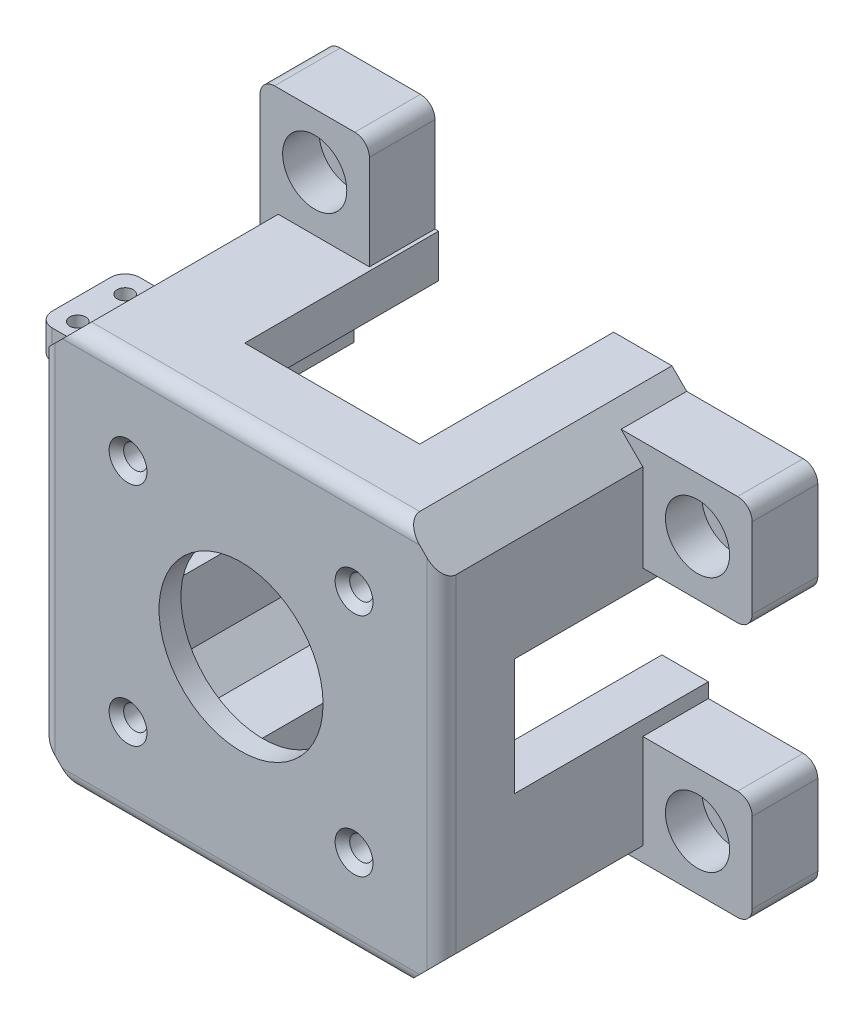
from build123d import *

# Parameters (mm, degrees)
SKETCH2_W           = 55
SKETCH2_H           = 55
BOSS_EXTRUDE1_DEPTH = 33.6
BOSS_EXTRUDE2_DEPTH = 3
SKETCH4_W           = 15
SKETCH4_H           = 15
SKETCH4_R           = 2.6
BOSS_EXTRUDE3_DEPTH = 9
CUT_EXTRUDE1_START  = -5
SKETCH6_R           = 4.4
SKETCH6_R_2         = 2.6
CUT_EXTRUDE1_DEPTH  = 5
CHAMFER1_SIZE       = 5
FILLET4_R           = 2
SKETCH7_W           = 24
SKETCH7_H           = 26.6
CUT_EXTRUDE2_DEPTH  = 67
SKETCH8_W           = 26.6
SKETCH8_H           = 16
CUT_EXTRUDE3_DEPTH  = 67
SKETCH11_W          = 12
SKETCH11_H          = 4
BOSS_EXTRUDE4_DEPTH = 5
SKETCH12_R          = 1.1
CUT_EXTRUDE5_DEPTH  = 4
FILLET8_R           = 2
SKETCH13_R          = 1.6
CUT_EXTRUDE6_DEPTH  = 10
CHAMFER2_SIZE       = 1


with BuildPart() as part:
    # Sketch2 → Boss-Extrude1 (new body)
    with BuildSketch(Plane.XY):
        with Locations((0, 0.476186899)):
            Rectangle(SKETCH2_W, SKETCH2_H)
        Polygon((21.118377871, -17.280631787), (21.118377871, 17.280631787), (17.280631787, 21.118377871), (-17.280631787, 21.118377871), (-21.118377871, 17.280631787), (-21.118377871, -17.280631787), (-17.280631787, -21.118377871), (17.280631787, -21.118377871), align=None, mode=Mode.SUBTRACT)
    extrude(amount=BOSS_EXTRUDE1_DEPTH)

    # Sketch3 → Boss-Extrude2 (add)
    with BuildSketch(Plane.XY.offset(33.6)):
        with BuildLine():
            Line((-7.954951288, 8.431138187), (-18.961411379, 19.437598278))
            Line((-18.961411379, 19.437598278), (-21.118377871, 17.280631787))
            Line((-21.118377871, 17.280631787), (-21.118377871, -17.280631787))
            Line((-21.118377871, -17.280631787), (-19.437598278, -18.961411379))
            Line((-19.437598278, -18.961411379), (-7.954951288, -7.478764389))
            ThreePointArc((-7.954951288, -7.478764389), (-11.25, 0.476186899), (-7.954951288, 8.431138187))
        make_face()
        with BuildLine():
            Line((-7.954951288, -7.478764389), (-19.437598278, -18.961411379))
            Line((-19.437598278, -18.961411379), (-17.280631787, -21.118377871))
            Line((-17.280631787, -21.118377871), (17.280631787, -21.118377871))
            Line((17.280631787, -21.118377871), (19.437598278, -18.961411379))
            Line((19.437598278, -18.961411379), (7.954951288, -7.478764389))
            ThreePointArc((7.954951288, -7.478764389), (0, -10.773813101), (-7.954951288, -7.478764389))
        make_face()
        with BuildLine():
            Line((21.118377871, 17.280631787), (18.961411379, 19.437598278))
            Line((18.961411379, 19.437598278), (7.954951288, 8.431138187))
            ThreePointArc((7.954951288, 8.431138187), (10.393644741, 4.781375513), (11.25, 0.476186899))
            ThreePointArc((11.25, 0.476186899), (10.393644741, -3.829001715), (7.954951288, -7.478764389))
            Line((7.954951288, -7.478764389), (19.437598278, -18.961411379))
            Line((19.437598278, -18.961411379), (21.118377871, -17.280631787))
            Line((21.118377871, -17.280631787), (21.118377871, 17.280631787))
        make_face()
        with BuildLine():
            Line((-17.280631787, 21.118377871), (-18.961411379, 19.437598278))
            Line((-18.961411379, 19.437598278), (-7.954951288, 8.431138187))
            ThreePointArc((-7.954951288, 8.431138187), (0, 11.726186899), (7.954951288, 8.431138187))
            Line((7.954951288, 8.431138187), (18.961411379, 19.437598278))
            Line((18.961411379, 19.437598278), (17.280631787, 21.118377871))
            Line((17.280631787, 21.118377871), (-17.280631787, 21.118377871))
        make_face()
        Polygon((-18.961411379, 19.437598278), (-27.5, 27.976186899), (-27.5, -27.023813101), (-19.437598278, -18.961411379), (-21.118377871, -17.280631787), (-21.118377871, 17.280631787), align=None)
        Polygon((-19.437598278, -18.961411379), (-27.5, -27.023813101), (27.5, -27.023813101), (19.437598278, -18.961411379), (17.280631787, -21.118377871), (-17.280631787, -21.118377871), align=None)
        Polygon((27.5, -27.023813101), (27.5, 27.976186899), (18.961411379, 19.437598278), (21.118377871, 17.280631787), (21.118377871, -17.280631787), (19.437598278, -18.961411379), align=None)
        Polygon((27.5, 27.976186899), (-27.5, 27.976186899), (-18.961411379, 19.437598278), (-17.280631787, 21.118377871), (17.280631787, 21.118377871), (18.961411379, 19.437598278), align=None)
    extrude(amount=BOSS_EXTRUDE2_DEPTH)

    # Sketch4 → Boss-Extrude3 (add)
    # profile 1 of 4: a face of its own
    with BuildSketch(Plane(origin=(0, 0, 0), x_dir=(-1, 0, 0), z_dir=(0, 0, -1))):
        with Locations((-35, 17.5)):
            Rectangle(SKETCH4_W, SKETCH4_H)
        with Locations((-35, 17.5)):
            Circle(SKETCH4_R, mode=Mode.SUBTRACT)
    # profile 2 of 4: a face of its own
    with BuildSketch(Plane(origin=(0, 0, 0), x_dir=(-1, 0, 0), z_dir=(0, 0, -1))):
        with Locations((35, 17.5)):
            Rectangle(SKETCH4_W, SKETCH4_H)
        with Locations((35, 17.5)):
            Circle(SKETCH4_R, mode=Mode.SUBTRACT)
    # profile 3 of 4: a face of its own
    with BuildSketch(Plane(origin=(0, 0, 0), x_dir=(-1, 0, 0), z_dir=(0, 0, -1))):
        with Locations((-35, -17.5)):
            Rectangle(SKETCH4_W, SKETCH4_H)
        with Locations((-35, -17.5)):
            Circle(SKETCH4_R, mode=Mode.SUBTRACT)
    # profile 4 of 4: a face of its own
    with BuildSketch(Plane(origin=(0, 0, 0), x_dir=(-1, 0, 0), z_dir=(0, 0, -1))):
        with Locations((17.5, -34.523813101)):
            Rectangle(SKETCH4_W, SKETCH4_H)
        with Locations((17.5, -34.523813101)):
            Circle(SKETCH4_R, mode=Mode.SUBTRACT)
    extrude(amount=-BOSS_EXTRUDE3_DEPTH)

    # Sketch6 → Cut-Extrude1 (cut)
    # profile 1 of 4: a face of its own
    with BuildSketch(Plane.XY.offset(9).offset(CUT_EXTRUDE1_START)):
        with Locations((-17.5, -34.523813101)):
            Circle(SKETCH6_R)
    # profile 2 of 4: a face of its own
    with BuildSketch(Plane.XY.offset(9).offset(CUT_EXTRUDE1_START)):
        with Locations((-35, 17.5)):
            Circle(SKETCH6_R)
    # profile 3 of 4: a face of its own
    with BuildSketch(Plane.XY.offset(9).offset(CUT_EXTRUDE1_START)):
        with Locations((35, -17.5)):
            Circle(SKETCH6_R)
        with Locations(Location((35, -17.5, 0), (0, 0, 180))):
            Circle(SKETCH6_R_2, mode=Mode.SUBTRACT)
    # profile 4 of 4: a face of its own
    with BuildSketch(Plane.XY.offset(9).offset(CUT_EXTRUDE1_START)):
        with Locations((35, 17.5)):
            Circle(SKETCH6_R)
    extrude(amount=CUT_EXTRUDE1_DEPTH, mode=Mode.SUBTRACT)

    # Chamfer1
    chamfer1_edges = [part.edges().sort_by_distance(p)[0] for p in [
        (27.5, -27.023813101, 18.3),
        (-27.5, -27.023813101, 18.3),
        (27.5, 27.976186899, 18.3),
        (-27.5, 27.976186899, 18.3),
    ]]
    chamfer(chamfer1_edges, length=CHAMFER1_SIZE)

    # Fillet4
    fillet4_edges = [part.edges().sort_by_distance(p)[0] for p in [
        (0, 27.976186899, 36.6),
        (27.5, 0.476186899, 36.6),
        (0, -27.023813101, 36.6),
        (-27.5, 0.476186899, 36.6),
        (-25, -42.023813101, 4.5),
        (-10, -42.023813101, 4.5),
        (-42.5, 10, 4.5),
        (-42.5, 25, 4.5),
        (42.5, -25, 4.5),
        (42.5, -10, 4.5),
        (42.5, 10, 4.5),
        (42.5, 25, 4.5),
    ]]
    fillet(fillet4_edges, radius=FILLET4_R)

    # Sketch7 → Cut-Extrude2 (cut)
    with BuildSketch(Plane.XZ.offset(27.023813101)):
        with Locations((2.5, 13.3)):
            Rectangle(SKETCH7_W, SKETCH7_H)
    extrude(amount=-CUT_EXTRUDE2_DEPTH, mode=Mode.SUBTRACT)

    # Sketch8 → Cut-Extrude3 (cut)
    with BuildSketch(Plane.ZY.offset(27.5)):
        with Locations((13.3, 0)):
            Rectangle(SKETCH8_W, SKETCH8_H)
    extrude(amount=-CUT_EXTRUDE3_DEPTH, mode=Mode.SUBTRACT)


with BuildPart() as body_2:
    # Mirror2: mirrored copy
    add(part.part.mirror(Plane(origin=(-25, -42.023813101, 9), x_dir=(0, 0, 1), z_dir=(0, 1, 0))))

    # Sketch11 → Boss-Extrude4 (add)
    with BuildSketch(Plane.ZY.offset(27.5)):
        with Locations((26, -65.023813101)):
            Rectangle(SKETCH11_W, SKETCH11_H)
    extrude(amount=BOSS_EXTRUDE4_DEPTH)

    # Sketch12 → Cut-Extrude5 (cut)
    with BuildSketch(Plane.XZ.offset(67.023813101)):
        with Locations(Location((-29.5, 29.5, 0), (0, 0, 270))):
            Circle(SKETCH12_R)
        with Locations(Location((-29.5, 23, 0), (0, 0, 270))):
            Circle(SKETCH12_R)
    extrude(amount=-CUT_EXTRUDE5_DEPTH, mode=Mode.SUBTRACT)

    # Fillet8
    fillet8_edges = [body_2.edges().sort_by_distance(p)[0] for p in [
        (-32.5, -65.023813101, 32),
        (-32.5, -65.023813101, 20),
    ]]
    fillet(fillet8_edges, radius=FILLET8_R)

    # Sketch13 → Cut-Extrude6 (cut)
    with BuildSketch(Plane.XY.offset(36.6)):
        with Locations((15.5, -100.023813101)):
            Circle(SKETCH13_R)
        with Locations((-15.5, -100.023813101)):
            Circle(SKETCH13_R)
        with Locations((-15.5, -69.023813101)):
            Circle(SKETCH13_R)
        with Locations((15.5, -69.023813101)):
            Circle(SKETCH13_R)
    extrude(amount=-CUT_EXTRUDE6_DEPTH, mode=Mode.SUBTRACT)

    # Chamfer2
    chamfer2_edges = [body_2.edges().sort_by_distance(p)[0] for p in [
        (13.9, -69.023813101, 36.6),
        (-17.1, -69.023813101, 36.6),
        (-17.1, -100.023813101, 36.6),
        (13.9, -100.023813101, 36.6),
    ]]
    chamfer(chamfer2_edges, length=CHAMFER2_SIZE)


solid = body_2.part
